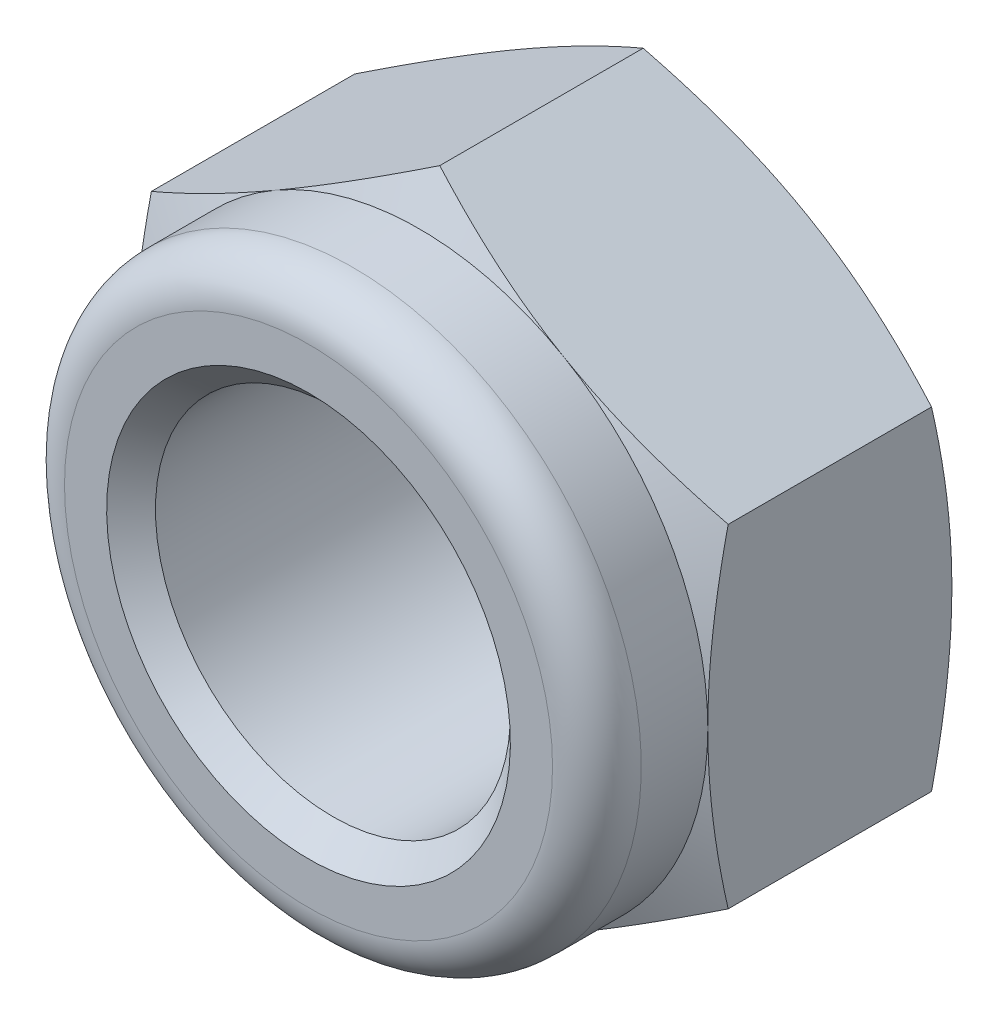
from build123d import *

# Parameters (mm, degrees)
SKETCH1_R           = 4
BOSS_EXTRUDE1_DEPTH = 5.5


with BuildPart() as part:
    # Sketch1 → Boss-Extrude1 (new body)
    with BuildSketch(Plane.XY):
        Polygon((0, -7.505553499), (6.5, -3.75277675), (6.5, 3.75277675), (0, 7.505553499), (-6.5, 3.75277675), (-6.5, -3.75277675), align=None)
        Circle(SKETCH1_R, mode=Mode.SUBTRACT)
    extrude(amount=BOSS_EXTRUDE1_DEPTH)

    # Sketch3 → Revolve1 (revolve)
    with BuildSketch(Plane(origin=(0, 0, 0), x_dir=(0, 0, -1), z_dir=(0, 1, 0))):
        with BuildLine():
            Line((-5.5, 6.5), (-7, 6.5))
            ThreePointArc((-7, 6.5), (-7.707106781, 6.207106781), (-8, 5.5))
            Line((-8, 5.5), (-8, 4))
            Line((-8, 4), (-5.5, 4))
            Line((-5.5, 4), (-5.5, 6.5))
        make_face()
    revolve(axis=Axis((0, 0, 0), (0, 0, 1)))

    # Sketch2 → Cut-Revolve1 (revolve, cut)
    with BuildSketch(Plane(origin=(0, 0, 0), x_dir=(0, 0, -1), z_dir=(1, 0, 0))):
        Polygon((-5.5, 7.505553499), (-5.5, 6.5), (-5.041666667, 7.505553499), align=None)
        Polygon((-0.458333333, 7.505553499), (0, 7.505553499), (0, 6.5), align=None)
        Polygon((-8, 4), (-7.45, 4), (-8, 4.55), align=None)
        Polygon((0, 4), (-0.55, 4), (0, 4.55), align=None)
    revolve(axis=Axis((0, 0, 0), (0, 0, 1)), mode=Mode.SUBTRACT)


solid = part.part
